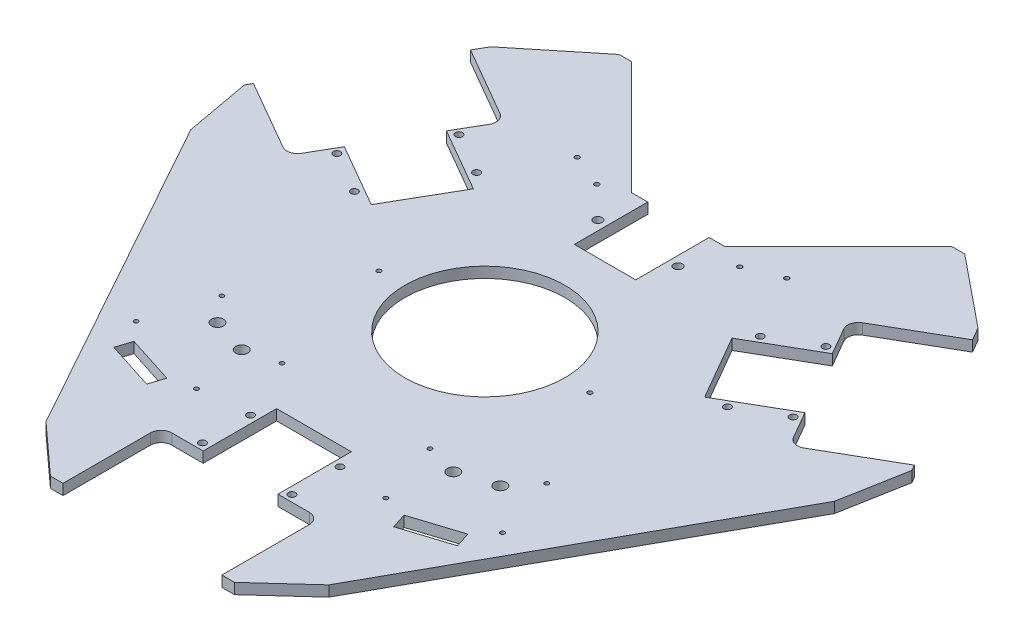
from build123d import *

# Parameters (mm, degrees)
SKETCH_1_W               = 119
SKETCH_1_H               = 62
EXTRUDE_1_DEPTH          = 8
CUT_EXTRUDE_1_REACH      = 360.247
HOLE_WIZARD_M5_1_D       = 5.3
SKETCH_11_W              = 119
SKETCH_11_H              = 11.469825071
CUT_EXTRUDE_5_DEPTH      = 359.24680204
PATTERN_CIRCULAR_1_COUNT = 3
CUT_EXTRUDE_2_DEPTH      = 359.24680204
CUT_EXTRUDE_2_DEPTH_BACK = 359.24680204
SKETCH_7_W               = 46
SKETCH_7_H               = 140
CUT_EXTRUDE_4_DEPTH      = 359.24680204
HOLE_WIZARD_M6_1_D       = 6.4
CUT_EXTRUDE_6936_REACH   = 360.247
SKETCH_10_R              = 60
FILLET_4_R               = 8
HOLE_WIZARD_M4_1_D       = 3.3
HOLE_WIZARD_M3_1_D       = 3.2
HOLE_WIZARD_9_0_9_1_D    = 9
CUT_EXTRUDE_6_DEPTH      = 10
HOLE_WIZARD_M3_3_D       = 3.4


with BuildPart() as part:
    # 草图1 → 凸台-拉伸1 (new body)
    with BuildSketch(Plane(origin=(0, 0, 0), x_dir=(1, 0, 0), z_dir=(0, 1, 0))):
        Polygon((-182.426223927, 186.923957016), (-250, 69.882743599), (-241.006855494, 20.698159104), (-105.890151719, -222.811211717), (-68.915866776, -256.469825071), (68.915866776, -256.469825071), (105.890151719, -222.811211717), (241.006855494, 20.698159104), (250, 69.882743599), (182.426223927, 186.923957016), (129.416945427, 230), (-129.416945427, 230), align=None)
        Polygon((188.232648893, 39.971488475), (128.732648893, 143.028511525), (182.426223927, 174.028511525), (241.926223927, 70.971488475), align=None, mode=Mode.SUBTRACT)
        Polygon((-128.732648893, 143.028511525), (-188.232648893, 39.971488475), (-241.926223927, 70.971488475), (-182.426223927, 174.028511525), align=None, mode=Mode.SUBTRACT)
        with Locations((0, -214)):
            Rectangle(SKETCH_1_W, SKETCH_1_H, mode=Mode.SUBTRACT)
    extrude(amount=EXTRUDE_1_DEPTH)

    # 草图2 → 切除-拉伸1 (cut, up to next)
    with BuildSketch(Plane(origin=(0, 8, 0), x_dir=(1, 0, 0), z_dir=(0, 1, 0)), mode=Mode.PRIVATE) as cut_extrude_1_sk1:
        Polygon((-124.851251684, 39.751288694), (-96.851251684, 88.248711306), (-144.482648893, 115.748711306), (-172.482648893, 67.251288694), align=None)
    cut_extrude_1_tool1 = extrude(cut_extrude_1_sk1.sketch, amount=-CUT_EXTRUDE_1_REACH, mode=Mode.PRIVATE) & part.part
    cut_extrude_1 = cut_extrude_1_tool1.solids().sort_by_distance((-134.66695, 8, -77.75))[0]
    add(cut_extrude_1, mode=Mode.SUBTRACT)

    # M5 间隙孔1 (through all)
    with Locations(Plane(origin=(0, 8, 0), x_dir=(-1, 0, 0), z_dir=(0, 1, 0))):
        with Locations((106.225607337, -100.011851027), (137.402521874, -118.011851027), (139.725607337, -41.988148973), (170.902521874, -59.988148973)):
            hole_wizard_m5_1 = Hole(HOLE_WIZARD_M5_1_D / 2)

    # 草图11 → 切除-拉伸5 (cut, through all)
    with BuildSketch(Plane(origin=(0, 8, 0), x_dir=(1, 0, 0), z_dir=(0, 1, 0))):
        Polygon((182.426223927, 174.028511525), (241.926223927, 70.971488475), (247.510115621, 74.195349848), (188.010115621, 177.252372898), align=None)
        with Locations((0, -250.734912536)):
            Rectangle(SKETCH_11_W, SKETCH_11_H)
        Polygon((-241.926223927, 70.971488475), (-182.426223927, 174.028511525), (-188.010115621, 177.252372898), (-247.510115621, 74.195349848), align=None)
    extrude(amount=-CUT_EXTRUDE_5_DEPTH, mode=Mode.SUBTRACT)

    # 阵列(圆周)1: 切除-拉伸1, M5 间隙孔1 ×3 about axis
    pattern_circular_1_axis = Axis((0, 0, 0), (0, 1, 0))
    add([cut_extrude_1.rotate(pattern_circular_1_axis, i * 360 / PATTERN_CIRCULAR_1_COUNT) for i in range(1, PATTERN_CIRCULAR_1_COUNT)], mode=Mode.SUBTRACT)
    add([hole_wizard_m5_1.rotate(pattern_circular_1_axis, i * 360 / PATTERN_CIRCULAR_1_COUNT) for i in range(1, PATTERN_CIRCULAR_1_COUNT)], mode=Mode.SUBTRACT)

    # 草图5 → 切除-拉伸2 (cut, two sides: drawn at the far end of the back side and taken through both)
    with BuildSketch(Plane(origin=(0, 8, 0), x_dir=(1, 0, 0), z_dir=(0, 1, 0)).offset(-CUT_EXTRUDE_2_DEPTH_BACK)):
        Polygon((35, 145), (120, 230), (-120, 230), (-35, 145), align=None)
    extrude(amount=CUT_EXTRUDE_2_DEPTH + CUT_EXTRUDE_2_DEPTH_BACK, mode=Mode.SUBTRACT)

    # 草图7 → 切除-拉伸4 (cut, through all)
    with BuildSketch(Plane(origin=(0, 8, 0), x_dir=(1, 0, 0), z_dir=(0, 1, 0))):
        with Locations((0, 160)):
            Rectangle(SKETCH_7_W, SKETCH_7_H)
    extrude(amount=-CUT_EXTRUDE_4_DEPTH, mode=Mode.SUBTRACT)

    # M6 间隙孔1 (through all)
    with Locations(Plane(origin=(0, 8, 0), x_dir=(1, 0, 0), z_dir=(0, 1, 0))):
        with Locations((30, 114.64), (-30, 114.64)):
            Hole(HOLE_WIZARD_M6_1_D / 2)

    # 草图10 → Cut-Extrude 6936 (cut, up to next)
    with BuildSketch(Plane(origin=(0, 8, 0), x_dir=(1, 0, 0), z_dir=(0, 1, 0)), mode=Mode.PRIVATE) as cut_extrude_6936_sk1:
        with Locations(Location((0, 0, 0), (0, 0, 270))):
            Circle(SKETCH_10_R)
    cut_extrude_6936_tool1 = extrude(cut_extrude_6936_sk1.sketch, amount=-CUT_EXTRUDE_6936_REACH, mode=Mode.PRIVATE) & part.part
    add(cut_extrude_6936_tool1.solids().sort_by_distance((0, 8, 0))[0], mode=Mode.SUBTRACT)

    # 圆角4
    fillet_4_edges = [part.edges().sort_by_distance(p)[0] for p in [
        (-128.732648893, 4, -143.028511525),
        (-188.232648893, 4, -39.971488475),
        (188.232648893, 4, -39.971488475),
        (128.732648893, 4, -143.028511525),
        (-59.5, 4, 183),
        (59.5, 4, 183),
    ]]
    fillet(fillet_4_edges, radius=FILLET_4_R)

    # M4 螺纹孔1 (through all)
    with Locations(Plane(origin=(0, 8, 0), x_dir=(1, 0, 0), z_dir=(0, 1, 0))):
        with Locations((-79, -0.36), (79, -0.36)):
            Hole(HOLE_WIZARD_M4_1_D / 2)

    # M3 间隙孔1 (through all)
    with Locations(Plane(origin=(0, 0, 0), x_dir=(-1, 0, 0), z_dir=(0, -1, 0))):
        with Locations((-121.660848414, -75.343344122), (-70.91, -145.125228485), (-137.200449982, -123.918242815), (-55.370398432, -96.550329791)):
            hole_wizard_m3_1 = Hole(HOLE_WIZARD_M3_1_D / 2)

    # Ø9.0 (9) 直径孔1 (through all)
    with Locations(Plane(origin=(0, 0, 0), x_dir=(-1, 0, 0), z_dir=(0, -1, 0))):
        with Locations((-105.902393669, -94.348635597), (-79.233821838, -102.880181556)):
            hole_wizard_9_0_9_1 = Hole(HOLE_WIZARD_9_0_9_1_D / 2)

    # 草图21 → 切除-拉伸6 (cut)
    with BuildSketch(Plane.XZ):
        Polygon((88.85332577, 149.359264422), (92.509702609, 160.78865235), (128.702764381, 149.210125692), (125.046387542, 137.780737764), align=None)
    cut_extrude_6 = extrude(amount=-CUT_EXTRUDE_6_DEPTH, mode=Mode.SUBTRACT)

    # M3 间隙孔3 (through all)
    with Locations(Plane(origin=(0, 0, 0), x_dir=(-1, 0, 0), z_dir=(0, -1, 0))):
        with Locations((53.517161568, 137.386324493), (78.508936531, 147.604503599)):
            hole_wizard_m3_3 = Hole(HOLE_WIZARD_M3_3_D / 2)

    # 镜向1: M3 间隙孔1, Ø9.0 (9) 直径孔1, 切除-拉伸6, M3 间隙孔3 across plane
    add(hole_wizard_m3_1.mirror(Plane(origin=(0, 0, 0), x_dir=(0, 0, 1), z_dir=(1, 0, 0))), mode=Mode.SUBTRACT)
    add(hole_wizard_9_0_9_1.mirror(Plane(origin=(0, 0, 0), x_dir=(0, 0, 1), z_dir=(1, 0, 0))), mode=Mode.SUBTRACT)
    add(cut_extrude_6.mirror(Plane(origin=(0, 0, 0), x_dir=(0, 0, 1), z_dir=(1, 0, 0))), mode=Mode.SUBTRACT)
    add(hole_wizard_m3_3.mirror(Plane(origin=(0, 0, 0), x_dir=(0, 0, 1), z_dir=(1, 0, 0))), mode=Mode.SUBTRACT)


solid = part.part
